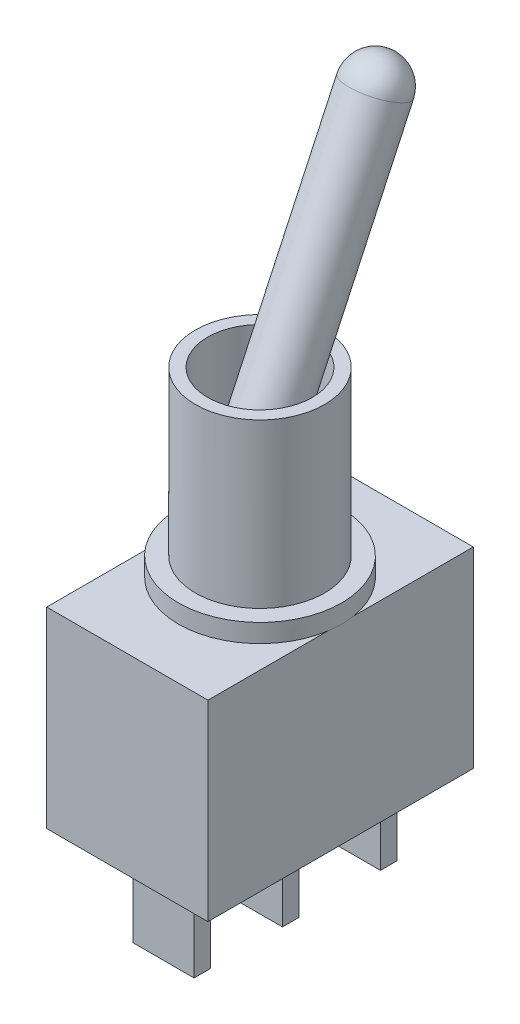
from build123d import *

# Parameters (mm, degrees)
SKETCH1_R           = 3.16357
SKETCH1_R_2         = 2.56357
BOSS_EXTRUDE1_DEPTH = 8
SKETCH2_R           = 4
BOSS_EXTRUDE2_DEPTH = 0.9
SKETCH3_W           = 7.9
SKETCH3_H           = 13
BOSS_EXTRUDE3_DEPTH = 9.4
SKETCH4_W           = 3
SKETCH4_H           = 0.8
BOSS_EXTRUDE4_DEPTH = 4.5


with BuildPart() as part:
    # Sketch1 → Boss-Extrude1 (new body)
    with BuildSketch(Plane(origin=(0, 0, 0), x_dir=(1, 0, 0), z_dir=(0, 1, 0))):
        with Locations(Location((0, 0, 0), (0, 0, 270))):
            Circle(SKETCH1_R)
        with Locations(Location((0, 0, 0), (0, 0, 270))):
            Circle(SKETCH1_R_2, mode=Mode.SUBTRACT)
    extrude(amount=BOSS_EXTRUDE1_DEPTH)

    # Sketch2 → Boss-Extrude2 (add)
    with BuildSketch(Plane.XZ):
        with Locations(Location((0, 0, 0), (0, 0, 270))):
            Circle(SKETCH2_R)
    extrude(amount=BOSS_EXTRUDE2_DEPTH)

    # Sketch3 → Boss-Extrude3 (add)
    with BuildSketch(Plane.XZ.offset(0.9)):
        Rectangle(SKETCH3_W, SKETCH3_H)
    extrude(amount=BOSS_EXTRUDE3_DEPTH)

    # Sketch4 → Boss-Extrude4 (add)
    with BuildSketch(Plane.XZ.offset(10.3)):
        with Locations((0, 4.330352395)):
            Rectangle(SKETCH4_W, SKETCH4_H)
        Rectangle(SKETCH4_W, SKETCH4_H)
        with Locations((0, -4.801802051)):
            Rectangle(SKETCH4_W, SKETCH4_H)
    extrude(amount=BOSS_EXTRUDE4_DEPTH)

    # Sketch5 → Revolve1 (revolve)
    with BuildSketch(Plane(origin=(0, 0, 0), x_dir=(0, 0, -1), z_dir=(1, 0, 0)), mode=Mode.PRIVATE) as revolve1_sk:
        with BuildLine():
            Line((4.373491762, 17.691665566), (-1.520701627, 5.051527053))
            Line((-1.520701627, 5.051527053), (-0.251870725, 4.459861486))
            Line((-0.251870725, 4.459861486), (6.23398823, 18.368830902))
            ThreePointArc((6.23398823, 18.368830902), (5.163494463, 18.415569669), (4.373491762, 17.691665566))
        make_face()
    revolve(revolve1_sk.sketch.rotate(Axis((0, 15.555621566, -4.922167173), (0, -0.9063077870366496, 0.4226182617407002)), 180), axis=Axis((0, 15.555621566, -4.922167173), (0, -0.9063077870366496, 0.4226182617407002)))


solid = part.part
